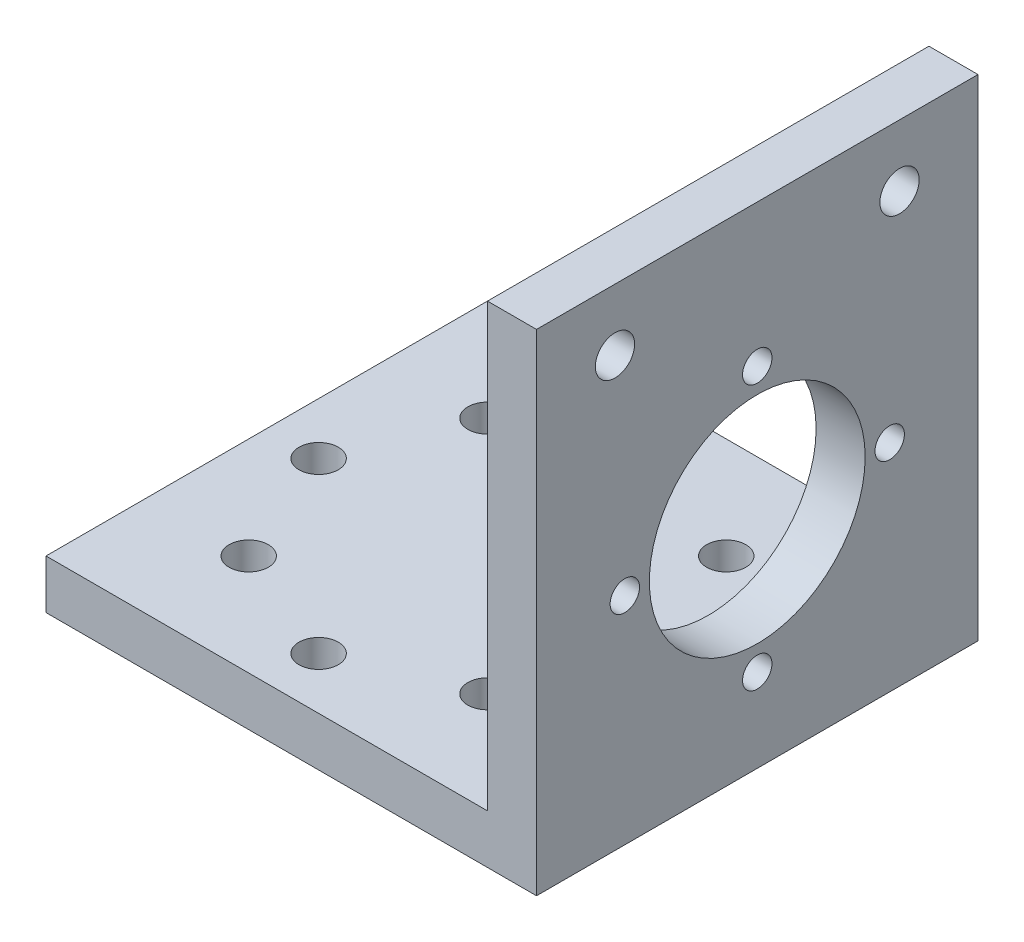
from build123d import *

# Parameters (mm, degrees)
BOSS_EXTRUDE1_DEPTH = 45
SKETCH2_R           = 11
CUT_EXTRUDE1_DEPTH  = 5
SKETCH3_R           = 1.5
CUT_EXTRUDE2_DEPTH  = 5
SKETCH4_R           = 2
CUT_EXTRUDE3_DEPTH  = 5
SKETCH5_R           = 2
CUT_EXTRUDE4_DEPTH  = 5


with BuildPart() as part:
    # Sketch1 → Boss-Extrude1 (new body)
    with BuildSketch(Plane.XY):
        Polygon((0, 50), (0, 0), (-50, 0), (-50, 5), (-5, 5), (-5, 50), align=None)
    extrude(amount=BOSS_EXTRUDE1_DEPTH)

    # Sketch2 → Cut-Extrude1 (cut)
    with BuildSketch(Plane(origin=(0, 0, 0), x_dir=(0, 0, -1), z_dir=(1, 0, 0))):
        with Locations((-22.5, 22)):
            Circle(SKETCH2_R)
    extrude(amount=-CUT_EXTRUDE1_DEPTH, mode=Mode.SUBTRACT)

    # Sketch3 → Cut-Extrude2 (cut)
    with BuildSketch(Plane(origin=(0, 0, 0), x_dir=(0, 0, -1), z_dir=(1, 0, 0))):
        with Locations((-22.5, 35.5)):
            Circle(SKETCH3_R)
        with Locations((-9, 22)):
            Circle(SKETCH3_R)
        with Locations((-22.5, 8.5)):
            Circle(SKETCH3_R)
        with Locations((-36, 22)):
            Circle(SKETCH3_R)
    extrude(amount=-CUT_EXTRUDE2_DEPTH, mode=Mode.SUBTRACT)

    # Sketch4 → Cut-Extrude3 (cut)
    with BuildSketch(Plane(origin=(0, 5, 0), x_dir=(1, 0, 0), z_dir=(0, 1, 0))):
        with Locations(Location((-27.5, -5.290295093, 0), (0, 0, 270))):
            Circle(SKETCH4_R)
        with Locations(Location((-15.330900958, -10.330900958, 0), (0, 0, 270))):
            Circle(SKETCH4_R)
        with Locations(Location((-10.290295093, -22.5, 0), (0, 0, 270))):
            Circle(SKETCH4_R)
        with Locations(Location((-15.330900958, -34.669099042, 0), (0, 0, 270))):
            Circle(SKETCH4_R)
        with Locations(Location((-27.5, -39.709704907, 0), (0, 0, 270))):
            Circle(SKETCH4_R)
        with Locations(Location((-39.669099042, -34.669099042, 0), (0, 0, 270))):
            Circle(SKETCH4_R)
        with Locations(Location((-44.709704907, -22.5, 0), (0, 0, 270))):
            Circle(SKETCH4_R)
        with Locations(Location((-39.669099042, -10.330900958, 0), (0, 0, 270))):
            Circle(SKETCH4_R)
    extrude(amount=-CUT_EXTRUDE3_DEPTH, mode=Mode.SUBTRACT)

    # Sketch5 → Cut-Extrude4 (cut)
    with BuildSketch(Plane(origin=(0, 0, 0), x_dir=(0, 0, -1), z_dir=(1, 0, 0))):
        with Locations((-37, 43.708447977)):
            Circle(SKETCH5_R)
        with Locations(Location((-8, 43.708447977, 0), (0, 0, 180))):
            Circle(SKETCH5_R)
    extrude(amount=-CUT_EXTRUDE4_DEPTH, mode=Mode.SUBTRACT)


solid = part.part
